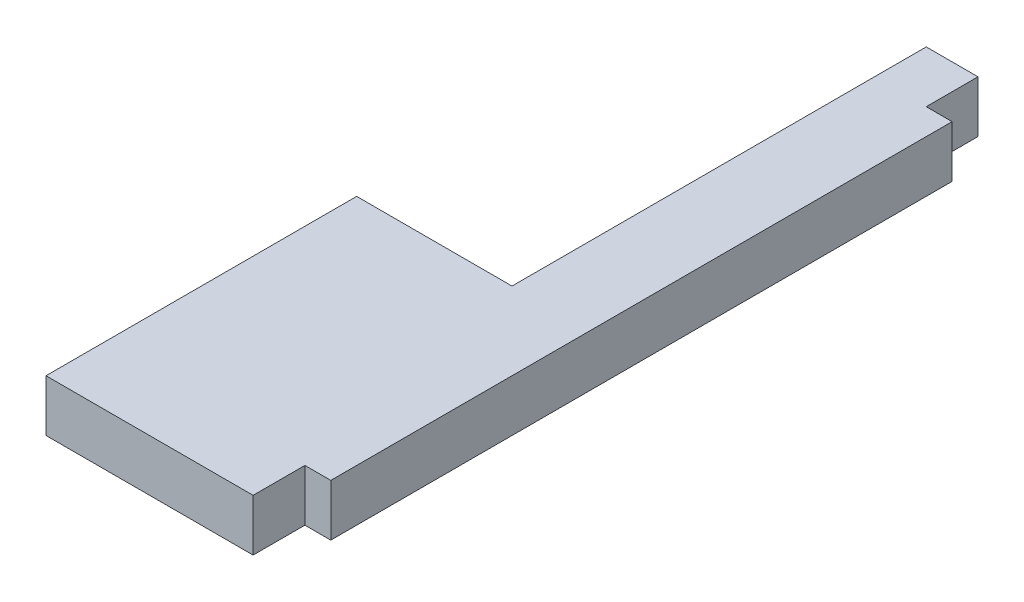
from build123d import *

# Parameters (mm, degrees)
BOSS_EXTRUDE1_DEPTH = 10


with BuildPart() as part:
    # Sketch1 → Boss-Extrude1 (new body)
    with BuildSketch(Plane(origin=(0, 0, 0), x_dir=(1, 0, 0), z_dir=(0, 1, 0))):
        Polygon((0, 0), (-30, 0), (-30, -60), (10, -60), (10, -50), (15, -50), (15, 70), (10, 70), (10, 80), (0, 80), align=None)
    extrude(amount=BOSS_EXTRUDE1_DEPTH)


solid = part.part
